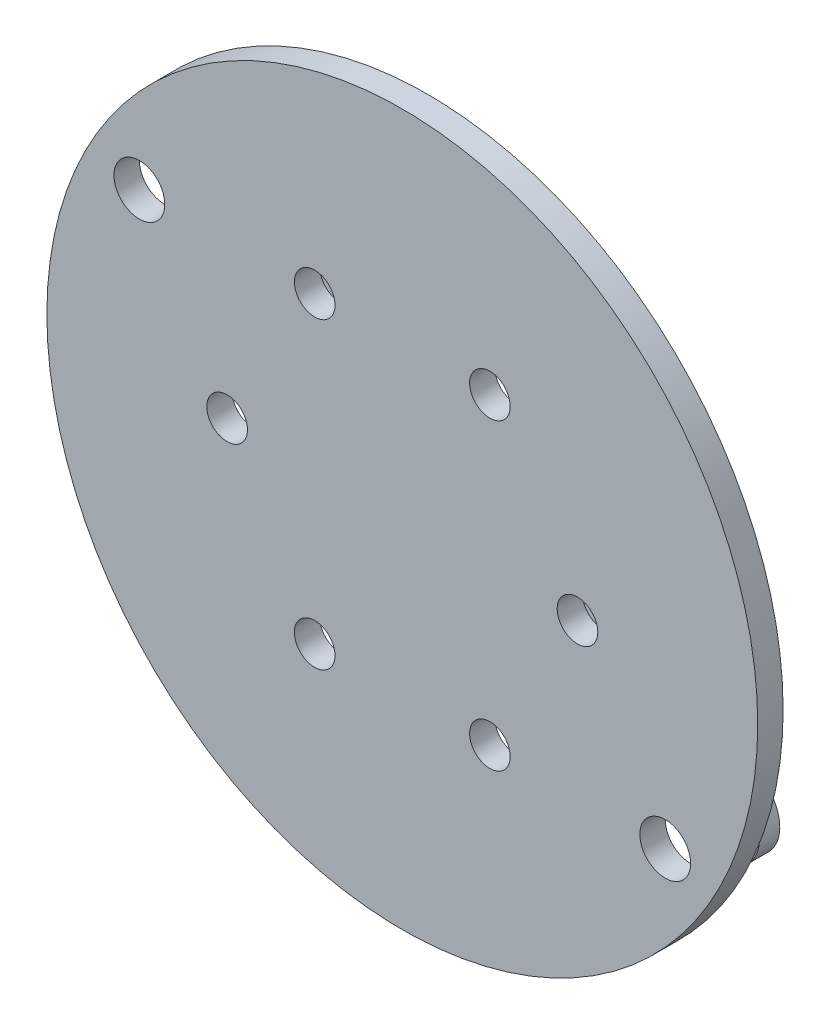
from build123d import *

# Parameters (mm, degrees)
SKETCH_1_R          = 35
SKETCH_1_R_2        = 2
EXTRUDE_1_DEPTH     = 2.5
SKETCH_2_R          = 5
EXTRUDE_2_DEPTH     = 5
EXTRUDE_3_DEPTH     = 2
EXTRUDE_START       = -2
EXTRUDE_4_DEPTH     = 2
SKETCH_6_R          = 2.5
CUT_EXTRUDE_1_DEPTH = 51.062460986


with BuildPart() as part:
    # 草图1 → 凸台-拉伸1 (new body)
    with BuildSketch(Plane.XY):
        Circle(SKETCH_1_R)
        with Locations((17.25, 0)):
            Circle(SKETCH_1_R_2, mode=Mode.SUBTRACT)
        with Locations((8.625, -14.938938215)):
            Circle(SKETCH_1_R_2, mode=Mode.SUBTRACT)
        with Locations((-8.625, -14.938938215)):
            Circle(SKETCH_1_R_2, mode=Mode.SUBTRACT)
        with Locations((-17.25, 0)):
            Circle(SKETCH_1_R_2, mode=Mode.SUBTRACT)
        with Locations((-8.625, 14.938938215)):
            Circle(SKETCH_1_R_2, mode=Mode.SUBTRACT)
        with Locations((8.625, 14.938938215)):
            Circle(SKETCH_1_R_2, mode=Mode.SUBTRACT)
    extrude(amount=EXTRUDE_1_DEPTH)

    # 草图2 → 凸台-拉伸2 (add)
    with BuildSketch(Plane(origin=(0, 0, 0), x_dir=(-1, 0, 0), z_dir=(0, 0, -1))):
        with Locations(Location((0, 0, 0), (0, 0, 180))):
            Circle(SKETCH_2_R)
    extrude(amount=EXTRUDE_2_DEPTH)

    # 草图3 → 凸台-拉伸3 (add)
    with BuildSketch(Plane(origin=(0, 0, -5), x_dir=(-1, 0, 0), z_dir=(0, 0, -1))):
        with BuildLine():
            Line((1.910748146, -3.264034868), (-23.979362284, -18.419963804))
            ThreePointArc((-23.979362284, -18.419963804), (-29.154145298, -17.066677082), (-27.800858576, -11.891894068))
            Line((-27.800858576, -11.891894068), (-1.910748146, 3.264034868))
            ThreePointArc((-1.910748146, 3.264034868), (3.264034868, 1.910748146), (1.910748146, -3.264034868))
        make_face()
    extrude(amount=-EXTRUDE_3_DEPTH)

    # 草图5 → 凸台-拉伸4 (add)
    with BuildSketch(Plane(origin=(0, 0, -5), x_dir=(-1, 0, 0), z_dir=(0, 0, -1)).offset(EXTRUDE_START)):
        with BuildLine():
            Line((23.995619313, 18.39219274), (0.959625284, 4.907047923))
            ThreePointArc((0.959625284, 4.907047923), (4.315018405, 2.525988156), (4.748607518, -1.565479685))
            Line((4.748607518, -1.565479685), (27.784601547, 11.919665132))
            ThreePointArc((27.784601547, 11.919665132), (29.126374234, 17.050420053), (23.995619313, 18.39219274))
        make_face()
    extrude(amount=EXTRUDE_4_DEPTH)

    # 草图6 → 切除-拉伸1 (cut, through all)
    with BuildSketch(Plane(origin=(0, 0, -5), x_dir=(-1, 0, 0), z_dir=(0, 0, -1))):
        with Locations((-25.89011043, -15.155928936)):
            Circle(SKETCH_6_R)
        with Locations((25.89011043, 15.155928936)):
            Circle(SKETCH_6_R)
    extrude(amount=-CUT_EXTRUDE_1_DEPTH, mode=Mode.SUBTRACT)


solid = part.part
